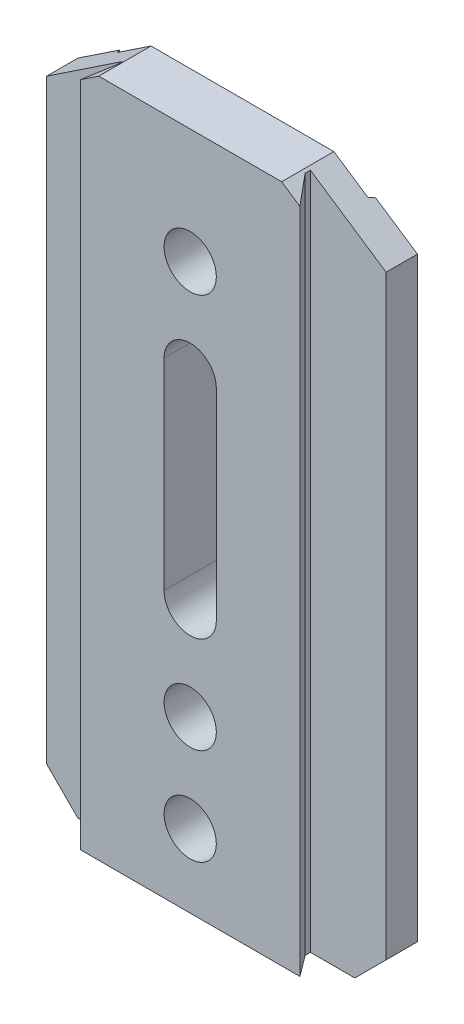
from build123d import *

# Parameters (mm, degrees)
SKETCH1_W                = 65
SKETCH1_H                = 130
MAIN_BODY_EXTRUDE_DEPTH  = 11
SKETCH4_R                = 5
BOLT_HOLES_DEPTH         = 11
UNDERCARRIAGE_CUT_DEPTH  = 135
TOP_CORNER_CUTS_DEPTH    = 11
BOTTOM_CORNER_CUTS_DEPTH = 11
TOP_CUT_DEPTH            = 130


with BuildPart() as part:
    # Sketch1 → Main Body Extrude (new body)
    with BuildSketch(Plane.XY):
        Rectangle(SKETCH1_W, SKETCH1_H)
    extrude(amount=MAIN_BODY_EXTRUDE_DEPTH)

    # Sketch4 → Bolt Holes (cut)
    with BuildSketch(Plane.XY.offset(11)):
        with Locations((0, -51)):
            Circle(SKETCH4_R)
        with Locations((0, -32.5)):
            Circle(SKETCH4_R)
        with Locations((0, 43)):
            Circle(SKETCH4_R)
        with BuildLine():
            Line((-5, -14), (-5, 24.5))
            ThreePointArc((-5, 24.5), (0, 29.5), (5, 24.5))
            Line((5, 24.5), (5, -14))
            ThreePointArc((5, -14), (0, -19), (-5, -14))
        make_face()
    extrude(amount=-BOLT_HOLES_DEPTH, mode=Mode.SUBTRACT)

    # Sketch6 → Undercarriage Cut (cut)
    with BuildSketch(Plane(origin=(0, 65, 0), x_dir=(1, 0, 0), z_dir=(0, 1, 0))):
        Polygon((21, -11), (18, -7), (18, -6), (32.5, -6), (32.5, -11), align=None)
        Polygon((-32.5, -11), (-21, -11), (-18, -7), (-18, -6), (-32.5, -6), align=None)
    extrude(amount=-UNDERCARRIAGE_CUT_DEPTH, mode=Mode.SUBTRACT)

    # Sketch2 → Top Corner Cuts (cut)
    with BuildSketch(Plane.XY.offset(11)):
        Polygon((-32.5, 55), (-17.5, 65), (-32.5, 65), align=None)
        Polygon((17.5, 65), (32.5, 55), (32.5, 65), align=None)
    extrude(amount=-TOP_CORNER_CUTS_DEPTH, mode=Mode.SUBTRACT)

    # Sketch3 → Bottom Corner Cuts (cut)
    with BuildSketch(Plane.XY.offset(11)):
        Polygon((-26.5, -65), (-32.5, -59), (-32.5, -65), align=None)
        Polygon((26.5, -65), (32.5, -59), (32.5, -65), align=None)
    extrude(amount=-BOTTOM_CORNER_CUTS_DEPTH, mode=Mode.SUBTRACT)

    # Sketch7 → Top Cut (cut)
    with BuildSketch(Plane(origin=(0, -65, 0), x_dir=(-1, 0, 0), z_dir=(0, -1, 0))):
        Polygon((24.5, 0), (-24.5, 0), (-24, -1), (24, -1), align=None)
    extrude(amount=-TOP_CUT_DEPTH, mode=Mode.SUBTRACT)


solid = part.part
